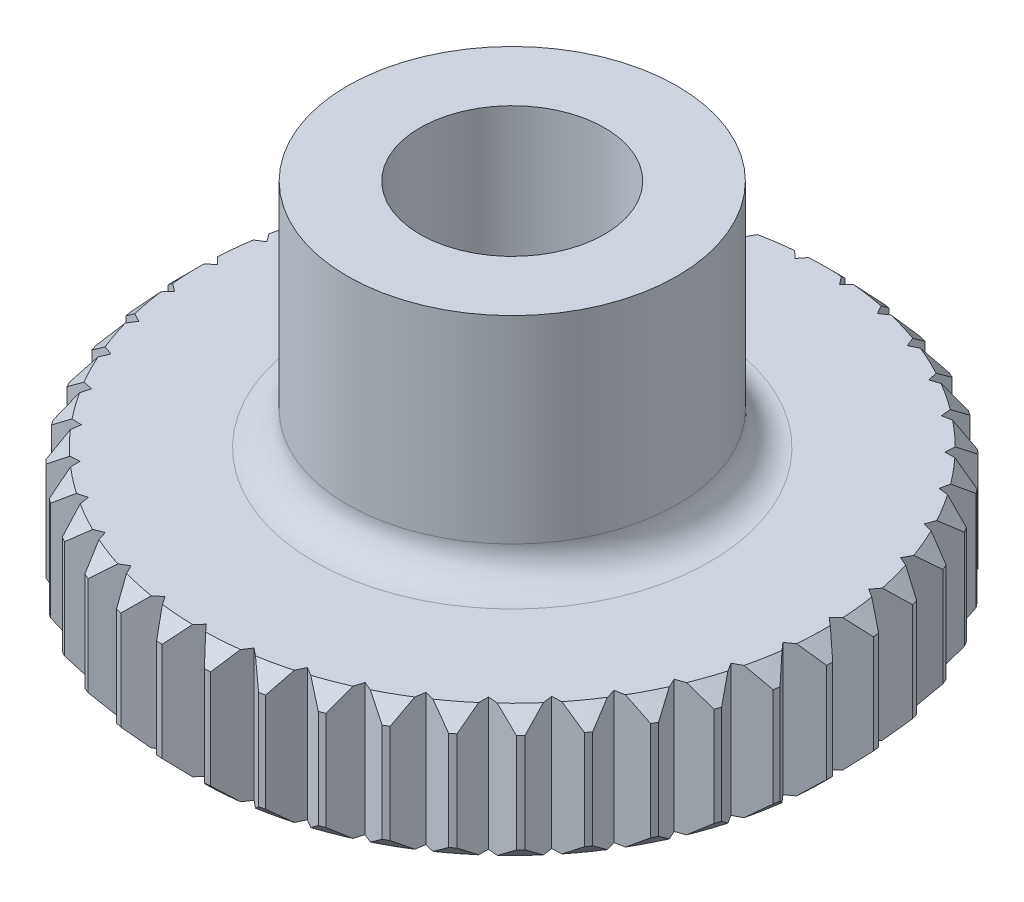
from build123d import *

# Parameters (mm, degrees)
SKICA1_R                 = 10
VYSUNOUT1_DEPTH          = 4
ZKOSIT1_SIZE             = 0.5
ODEBRAT_VYSUNUT_M1_DEPTH = 15.696938457
KRUHOV_POLE1_COUNT       = 43
SKICA3_R                 = 5
VYSUNOUT2_DEPTH          = 11
ZAOBLIT1_R               = 1
SKICA4_R                 = 2.125
ODEBRAT_VYSUNUT_M2_DEPTH = 18.914349881


with BuildPart() as part:
    # Skica1 → Vysunout1 (new body)
    with BuildSketch(Plane(origin=(0, 0, 0), x_dir=(1, 0, 0), z_dir=(0, 1, 0))):
        with Locations(Location((0, 0, 0), (0, 0, 270))):
            Circle(SKICA1_R)
    extrude(amount=VYSUNOUT1_DEPTH)

    # Zkosit1
    zkosit1_edges = [part.edges().sort_by_distance(p)[0] for p in [
        (0, 0, -10),
        (0, 4, -10),
    ]]
    chamfer(zkosit1_edges, length=ZKOSIT1_SIZE)

    # Skica2 → Odebrat vysunutím1 (cut, through all)
    with BuildSketch(Plane.XZ):
        with BuildLine():
            Line((0.6407022, 9.979453928), (0, 9.28025017))
            Line((0, 9.28025017), (-0.6407022, 9.979453928))
            ThreePointArc((-0.6407022, 9.979453928), (0, 10), (0.6407022, 9.979453928))
        make_face()
    odebrat_vysunut_m1 = extrude(amount=-ODEBRAT_VYSUNUT_M1_DEPTH, mode=Mode.SUBTRACT)

    # Kruhové pole1: Odebrat vysunutím1 ×43 about axis
    kruhov_pole1_axis = Axis((0, 0, 0), (0, 1, 0))
    for i in range(1, KRUHOV_POLE1_COUNT):
        add(odebrat_vysunut_m1.rotate(kruhov_pole1_axis, i * 360 / KRUHOV_POLE1_COUNT), mode=Mode.SUBTRACT)

    # Skica3 → Vysunout2 (add)
    with BuildSketch(Plane.XZ):
        with Locations(Location((0, 0, 0), (0, 0, 270))):
            Circle(SKICA3_R)
    extrude(amount=-VYSUNOUT2_DEPTH)

    # Zaoblit1
    zaoblit1_edges = [part.edges().sort_by_distance(p)[0] for p in [
        (0, 4, 5),
    ]]
    fillet(zaoblit1_edges, radius=ZAOBLIT1_R)

    # Skica4 → Odebrat vysunutím2 (cut, through all)
    with BuildSketch(Plane.XZ):
        with Locations(Location((0, 0, 0), (0, 0, 270))):
            Circle(SKICA4_R)
    extrude(amount=-ODEBRAT_VYSUNUT_M2_DEPTH, mode=Mode.SUBTRACT)

    # Skica5 → Odebrat otočením1 (revolve, cut)
    with BuildSketch(Plane(origin=(0, 0, 0), x_dir=(0, 0, -1), z_dir=(1, 0, 0))):
        Polygon((-2.8, 11), (-2.8, 6.5), (0, 4.883419246), (0, 11), align=None)
    revolve(axis=Axis((0, 11, 0), (0, -1, 0)), mode=Mode.SUBTRACT)


solid = part.part
